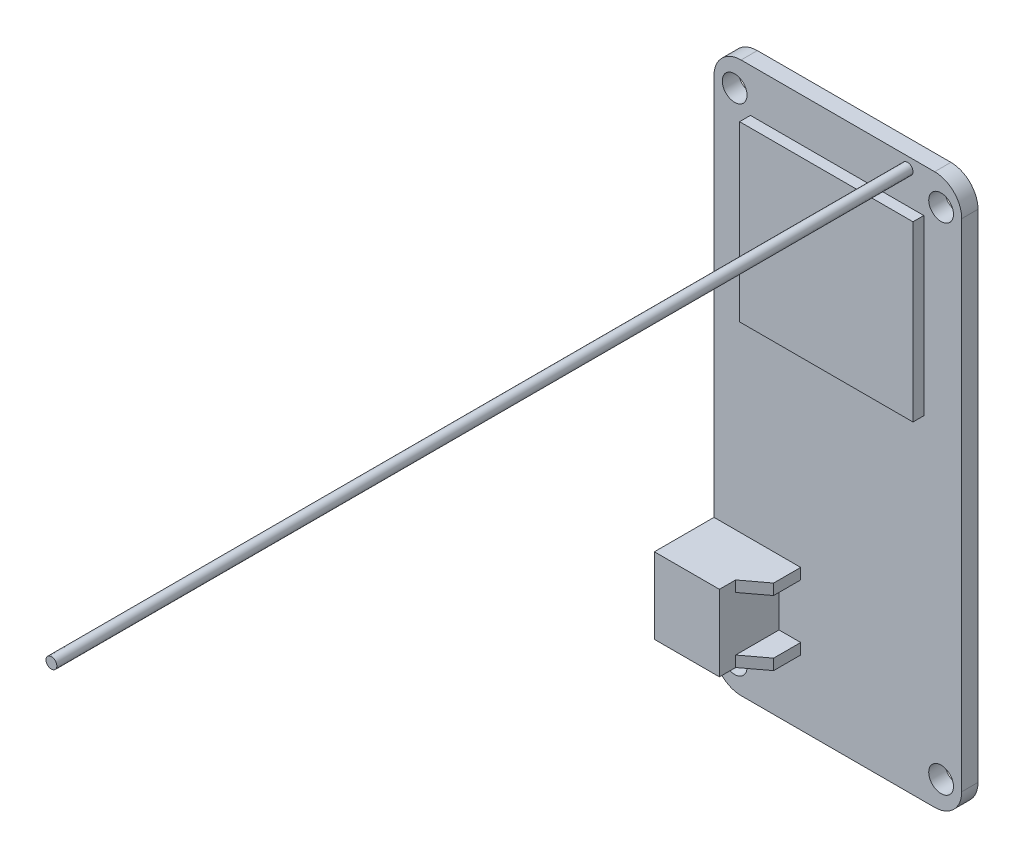
from build123d import *

# Parameters (mm, degrees)
SKETCH1_R               = 1.143
BOSS_EXTRUDE1_DEPTH     = 1.5
CROQUIS1_W              = 16
CROQUIS1_H              = 16
SALIENTE_EXTRUIR1_DEPTH = 1
CROQUIS2_R              = 0.5
SALIENTE_EXTRUIR2_DEPTH = 79
SALIENTE_EXTRUIR3_DEPTH = 5.5
CORTAR_EXTRUIR1_DEPTH   = 95.596612016


with BuildPart() as part:
    # Sketch1 → Boss-Extrude1 (new body)
    with BuildSketch(Plane.XY.offset(3.527777778)):
        with BuildLine():
            Line((-11.43, 22.9), (-11.43, -22.9))
            ThreePointArc((-11.43, -22.9), (-10.697766953, -24.667766953), (-8.93, -25.4))
            Line((-8.93, -25.4), (8.93, -25.4))
            ThreePointArc((8.93, -25.4), (10.697766953, -24.667766953), (11.43, -22.9))
            Line((11.43, -22.9), (11.43, 22.9))
            ThreePointArc((11.43, 22.9), (10.697766953, 24.667766953), (8.93, 25.4))
            Line((8.93, 25.4), (-8.93, 25.4))
            ThreePointArc((-8.93, 25.4), (-10.697766953, 24.667766953), (-11.43, 22.9))
        make_face()
        with Locations(Location((9.525, 22.86, 0), (0, 0, 180))):
            Circle(SKETCH1_R, mode=Mode.SUBTRACT)
        with Locations(Location((-9.525, 22.86, 0), (0, 0, 180))):
            Circle(SKETCH1_R, mode=Mode.SUBTRACT)
        with Locations(Location((-9.525, -22.86, 0), (0, 0, 180))):
            Circle(SKETCH1_R, mode=Mode.SUBTRACT)
        with Locations(Location((9.525, -22.86, 0), (0, 0, 180))):
            Circle(SKETCH1_R, mode=Mode.SUBTRACT)
    extrude(amount=-BOSS_EXTRUDE1_DEPTH)

    # Croquis1 → Saliente-Extruir1 (add)
    with BuildSketch(Plane.XY.offset(3.527777778)):
        with Locations((-0.07, 13.4)):
            Rectangle(CROQUIS1_W, CROQUIS1_H)
    extrude(amount=SALIENTE_EXTRUIR1_DEPTH)

    # Croquis2 → Saliente-Extruir2 (add)
    with BuildSketch(Plane.XY.offset(3.527777778)):
        with Locations((6.43, 24.4)):
            Circle(CROQUIS2_R)
    extrude(amount=SALIENTE_EXTRUIR2_DEPTH)

    # Croquis3 → Saliente-Extruir3 (add)
    with BuildSketch(Plane.XY.offset(3.527777778)):
        Polygon((-11.43, -12.4), (-3.43, -12.4), (-3.43, -13.4), (-5.43, -13.4), (-5.43, -18.4), (-3.43, -18.4), (-3.43, -19.4), (-11.43, -19.4), align=None)
    extrude(amount=SALIENTE_EXTRUIR3_DEPTH)

    # Croquis4 → Cortar-Extruir1 (cut, through all)
    with BuildSketch(Plane.XZ.offset(19.4)):
        Polygon((-5.43, 9.027777778), (-5.43, 7.527777778), (-3.43, 6.027777778), (-3.43, 9.027777778), align=None)
    extrude(amount=-CORTAR_EXTRUIR1_DEPTH, mode=Mode.SUBTRACT)


solid = part.part
